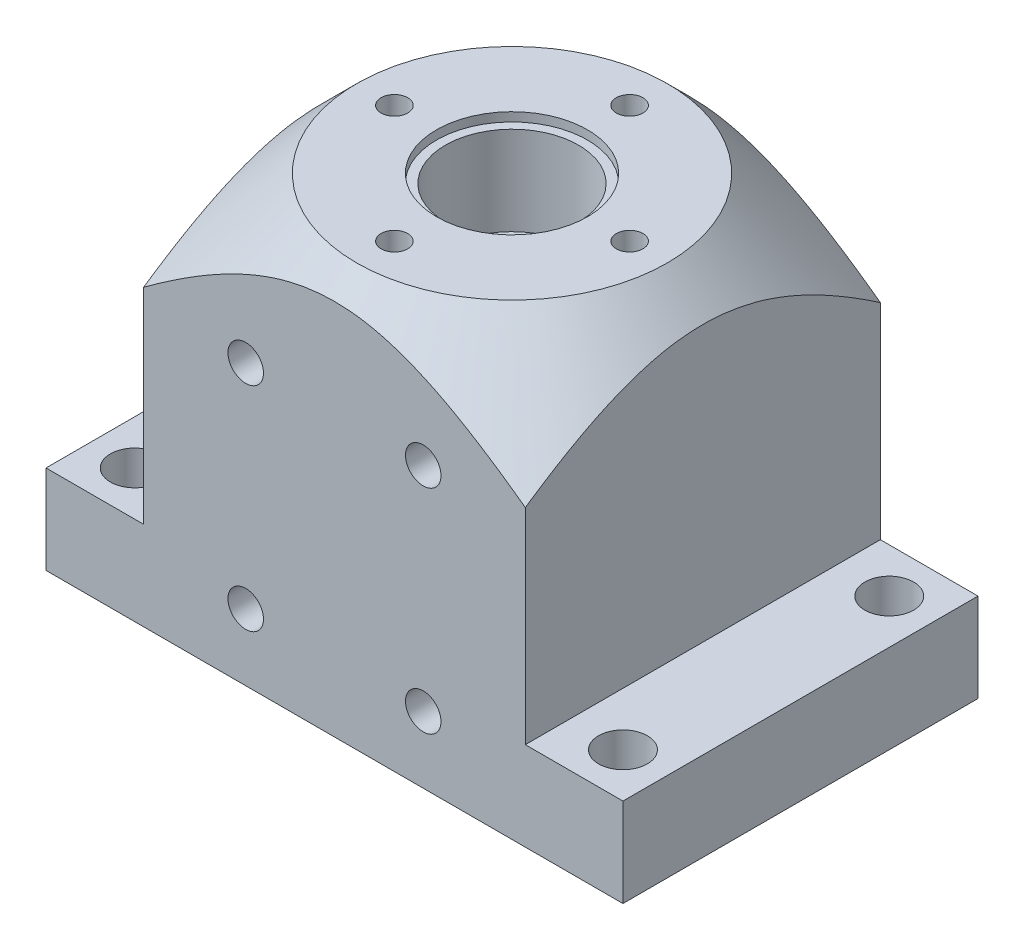
from build123d import *

# Parameters (mm, degrees)
SALIENTE_EXTRUIR1_DEPTH      = 40
SALIENTE_EXTRUIR1_DEPTH_BACK = 40
CROQUIS2_R                   = 17
CORTAR_EXTRUIR1_DEPTH        = 2
CORTAR_EXTRUIR2_REACH        = 118.486
CROQUIS5_R                   = 13
CROQUIS6_R                   = 15
CORTAR_EXTRUIR3_DEPTH        = 20
CORTAR_EXTRUIR4_START        = -20
CROQUIS7_R                   = 15
CORTAR_EXTRUIR4_DEPTH        = 20
CORTAR_EXTRUIR6_REACH        = 105.562
CROQUIS8_R                   = 5.5
CROQUIS9_R                   = 4
CORTAR_EXTRUIR7_DEPTH        = 30
CROQUIS10_R                  = 3
CORTAR_EXTRUIR8_DEPTH        = 25


with BuildPart() as part:
    # Croquis1 → Saliente-Extruir1 (new, two sides: drawn at the far end of the back side and taken through both)
    with BuildSketch(Plane.XY.offset(-SALIENTE_EXTRUIR1_DEPTH_BACK)):
        Polygon((65, 0), (-65, 0), (-65, 20), (-43, 20), (-43, 90), (43, 90), (43, 20), (65, 20), align=None)
    extrude(amount=SALIENTE_EXTRUIR1_DEPTH + SALIENTE_EXTRUIR1_DEPTH_BACK)

    # Croquis2 → Cortar-Extruir1 (cut)
    with BuildSketch(Plane(origin=(0, 90, 0), x_dir=(1, 0, 0), z_dir=(0, 1, 0))):
        Circle(CROQUIS2_R)
    extrude(amount=-CORTAR_EXTRUIR1_DEPTH, mode=Mode.SUBTRACT)

    # Croquis4 → Cortar-Revolución2 (revolve, cut)
    with BuildSketch(Plane.XY):
        Polygon((-35, 90), (-75.552498824, 49.447501176), (-75.552498824, 90), align=None)
    revolve(axis=Axis((0, 0, 0), (0, -1, 0)), mode=Mode.SUBTRACT)

    # Croquis5 → Cortar-Extruir2 (cut, up to next)
    with BuildSketch(Plane(origin=(0, 88, 0), x_dir=(1, 0, 0), z_dir=(0, 1, 0)), mode=Mode.PRIVATE) as cortar_extruir2_sk1:
        Circle(CROQUIS5_R)
    cortar_extruir2_tool1 = extrude(cortar_extruir2_sk1.sketch, amount=-CORTAR_EXTRUIR2_REACH, mode=Mode.PRIVATE) & part.part
    add(cortar_extruir2_tool1.solids().sort_by_distance((0, 88, 0))[0], mode=Mode.SUBTRACT)

    # Croquis6 → Cortar-Extruir3 (cut)
    with BuildSketch(Plane(origin=(0, 88, 0), x_dir=(1, 0, 0), z_dir=(0, 1, 0))):
        Circle(CROQUIS6_R)
    extrude(amount=-CORTAR_EXTRUIR3_DEPTH, mode=Mode.SUBTRACT)

    # Croquis7 → Cortar-Extruir4 (cut)
    with BuildSketch(Plane.XZ.offset(CORTAR_EXTRUIR4_START)):
        Circle(CROQUIS7_R)
    extrude(amount=CORTAR_EXTRUIR4_DEPTH, mode=Mode.SUBTRACT)

    # Croquis8 → Cortar-Extruir6 (cut, up to next)
    with BuildSketch(Plane(origin=(0, 20, 0), x_dir=(1, 0, 0), z_dir=(0, 1, 0)), mode=Mode.PRIVATE) as cortar_extruir6_sk1:
        with Locations((-55, 30)):
            Circle(CROQUIS8_R)
    cortar_extruir6_tool1 = extrude(cortar_extruir6_sk1.sketch, amount=-CORTAR_EXTRUIR6_REACH, mode=Mode.PRIVATE) & part.part
    # Croquis8 → Cortar-Extruir6 (cut, up to next)
    with BuildSketch(Plane(origin=(0, 20, 0), x_dir=(1, 0, 0), z_dir=(0, 1, 0)), mode=Mode.PRIVATE) as cortar_extruir6_sk2:
        with Locations((-55, -30)):
            Circle(CROQUIS8_R)
    cortar_extruir6_tool2 = extrude(cortar_extruir6_sk2.sketch, amount=-CORTAR_EXTRUIR6_REACH, mode=Mode.PRIVATE) & part.part
    # Croquis8 → Cortar-Extruir6 (cut, up to next)
    with BuildSketch(Plane(origin=(0, 20, 0), x_dir=(1, 0, 0), z_dir=(0, 1, 0)), mode=Mode.PRIVATE) as cortar_extruir6_sk3:
        with Locations((55, 30)):
            Circle(CROQUIS8_R)
    cortar_extruir6_tool3 = extrude(cortar_extruir6_sk3.sketch, amount=-CORTAR_EXTRUIR6_REACH, mode=Mode.PRIVATE) & part.part
    # Croquis8 → Cortar-Extruir6 (cut, up to next)
    with BuildSketch(Plane(origin=(0, 20, 0), x_dir=(1, 0, 0), z_dir=(0, 1, 0)), mode=Mode.PRIVATE) as cortar_extruir6_sk4:
        with Locations((55, -30)):
            Circle(CROQUIS8_R)
    cortar_extruir6_tool4 = extrude(cortar_extruir6_sk4.sketch, amount=-CORTAR_EXTRUIR6_REACH, mode=Mode.PRIVATE) & part.part
    add(cortar_extruir6_tool1.solids().sort_by_distance((-55, 20, -30))[0], mode=Mode.SUBTRACT)
    add(cortar_extruir6_tool2.solids().sort_by_distance((-55, 20, 30))[0], mode=Mode.SUBTRACT)
    add(cortar_extruir6_tool3.solids().sort_by_distance((55, 20, -30))[0], mode=Mode.SUBTRACT)
    add(cortar_extruir6_tool4.solids().sort_by_distance((55, 20, 30))[0], mode=Mode.SUBTRACT)

    # Croquis9 → Cortar-Extruir7 (cut)
    with BuildSketch(Plane.XY.offset(40)):
        with Locations((-20, 63)):
            Circle(CROQUIS9_R)
        with Locations((20, 63)):
            Circle(CROQUIS9_R)
        with Locations((20, 15)):
            Circle(CROQUIS9_R)
        with Locations((-20, 15)):
            Circle(CROQUIS9_R)
    extrude(amount=-CORTAR_EXTRUIR7_DEPTH, mode=Mode.SUBTRACT)

    # Croquis10 → Cortar-Extruir8 (cut)
    with BuildSketch(Plane(origin=(0, 90, 0), x_dir=(1, 0, 0), z_dir=(0, 1, 0))):
        with Locations((0, 26.5)):
            Circle(CROQUIS10_R)
        with Locations((26.5, 0)):
            Circle(CROQUIS10_R)
        with Locations((0, -26.5)):
            Circle(CROQUIS10_R)
        with Locations((-26.5, 0)):
            Circle(CROQUIS10_R)
    extrude(amount=-CORTAR_EXTRUIR8_DEPTH, mode=Mode.SUBTRACT)


solid = part.part
